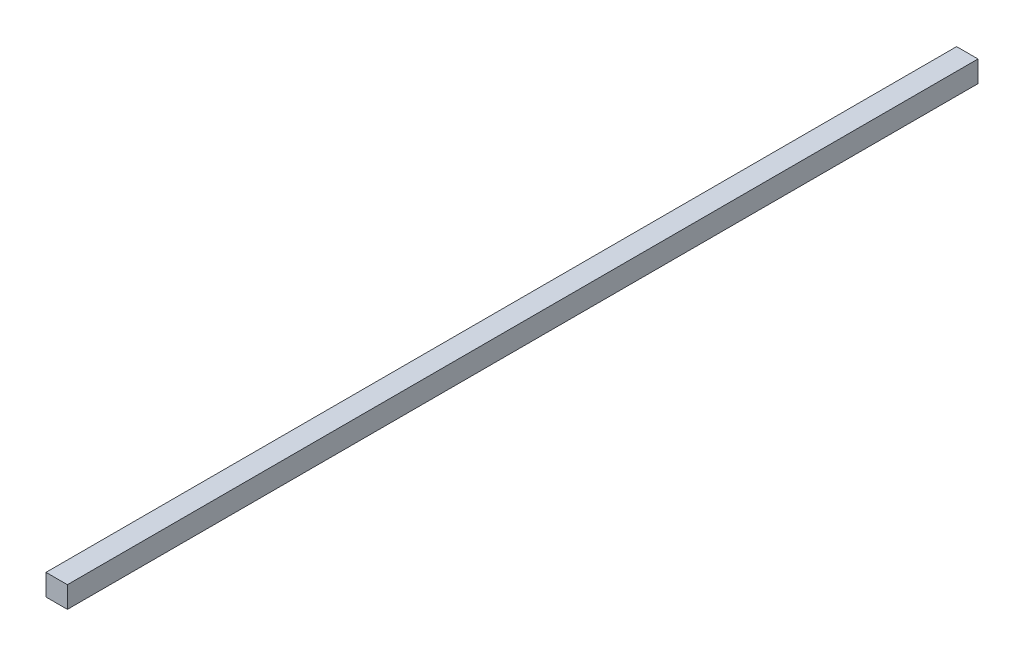
from build123d import *

# Parameters (mm, degrees)
SKETCH1_W           = 6
SKETCH1_H           = 6
BOSS_EXTRUDE1_DEPTH = 255.31


with BuildPart() as part:
    # Sketch1 → Boss-Extrude1 (new body)
    with BuildSketch(Plane.XY):
        Rectangle(SKETCH1_W, SKETCH1_H)
    extrude(amount=BOSS_EXTRUDE1_DEPTH)


solid = part.part
